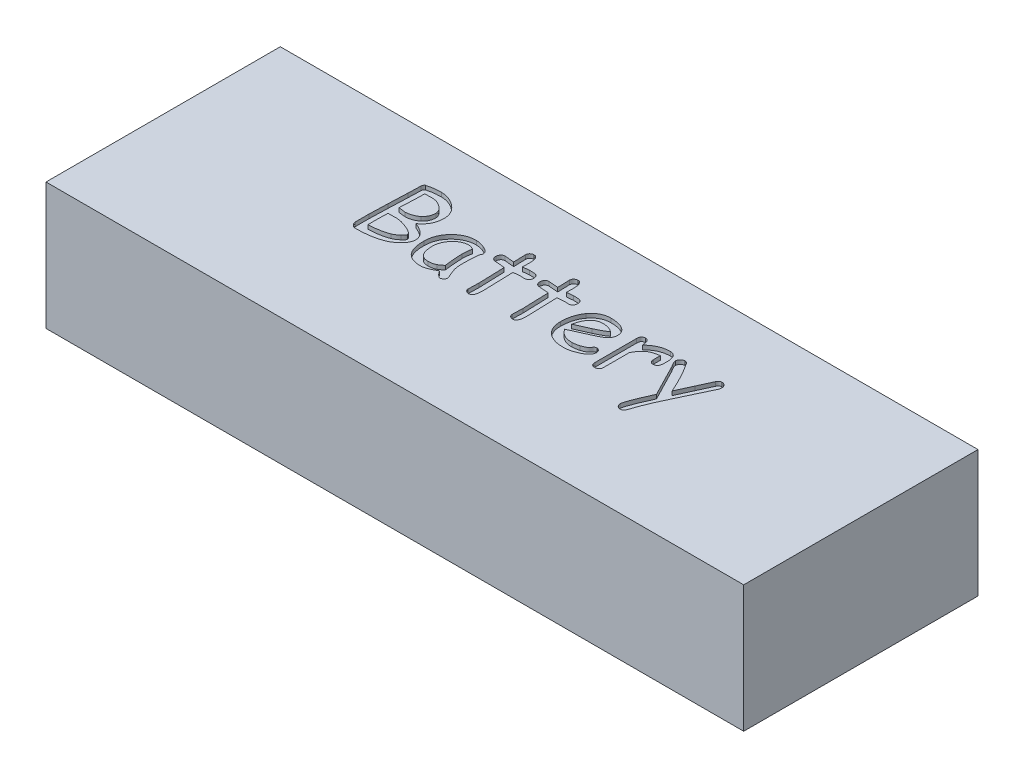
from build123d import *

# Parameters (mm, degrees)
SKETCH1_W           = 136.906
SKETCH1_H           = 45.974
BOSS_EXTRUDE1_DEPTH = 24.892
CUT_EXTRUDE1_DEPTH  = 0.79375


with BuildPart() as part:
    # Sketch1 → Boss-Extrude1 (new body)
    with BuildSketch(Plane(origin=(0, 0, 0), x_dir=(1, 0, 0), z_dir=(0, 1, 0))):
        Rectangle(SKETCH1_W, SKETCH1_H)
    extrude(amount=BOSS_EXTRUDE1_DEPTH)

    # Sketch2 → Cut-Extrude1 (cut)
    # profile 1 of 7: a face of its own
    with BuildSketch(Plane(origin=(0, 24.892, 0), x_dir=(1, 0, 0), z_dir=(0, 1, 0))):
        with BuildLine():
            add(Edge.make_bspline(
                [(-25.187474213, 0.283035049), (-25.357803893, 0.219193014), (-25.706357139, 0.088550201), (-26.255416364, -0.0710962), (-26.838574292, -0.205197941), (-27.456567078, -0.315880138), (-28.108751778, -0.40304193), (-28.796386754, -0.462400617), (-29.517223284, -0.500128275), (-30.009602327, -0.505257631), (-30.260943604, -0.507875977)],
                knots=[0, 0, 0, 0, 0.845148608, 1.729465408, 2.654896534, 3.625080711, 4.646240167, 5.711756778, 6.831936531, 8, 8, 8, 8], degree=3))
            add(Edge.make_bspline(
                [(-30.260943604, -0.507875977), (-30.324140737, -0.502940378), (-30.451313693, -0.493008367), (-30.638276885, -0.420723863), (-30.818321547, -0.305299883), (-30.985191566, -0.148383564), (-31.128659408, 0.029935653), (-31.238577295, 0.217978156), (-31.306286107, 0.41164244), (-31.314821228, 0.543533071), (-31.319018555, 0.608393097)],
                knots=[0, 0, 0, 0, 0.905166651, 1.821486394, 2.83904999, 3.957846056, 5.091625874, 6.111309478, 7.071196234, 8, 8, 8, 8], degree=3))
            Line((-31.319018555, 0.608393097), (-31.319018555, 3.224483414))
            add(Edge.make_bspline(
                [(-31.319018555, 3.224483414), (-31.318296118, 3.337346422), (-31.316777815, 3.574543801), (-31.311070947, 3.947516089), (-31.30371577, 4.354915432), (-31.290473699, 4.796689907), (-31.270205718, 5.271813018), (-31.253437001, 5.781588539), (-31.22916266, 6.325613956), (-31.20990827, 6.700271044), (-31.199985123, 6.893358307)],
                knots=[0, 0, 0, 0, 0.737849974, 1.550694791, 2.438561872, 3.401627494, 4.439981643, 5.54745813, 6.736031923, 8, 8, 8, 8], degree=3))
            add(Edge.make_bspline(
                [(-31.199985123, 6.893358307), (-31.189140744, 7.100551724), (-31.168285036, 7.499022252), (-31.142382479, 8.074863222), (-31.118699793, 8.606548988), (-31.096526243, 9.094073454), (-31.081636991, 9.53765626), (-31.067171675, 9.936139865), (-31.059831047, 10.290645746), (-31.056194736, 10.511973832), (-31.054499817, 10.615136948)],
                knots=[0, 0, 0, 0, 1.336822694, 2.570952543, 3.714018919, 4.766024101, 5.715397503, 6.573729646, 7.335201894, 8, 8, 8, 8], degree=3))
            add(Edge.make_bspline(
                [(-31.054499817, 10.615136948), (-31.054663976, 10.688321054), (-31.055012083, 10.843511368), (-31.052063806, 11.088643523), (-31.046697627, 11.359339771), (-31.038714813, 11.65472493), (-31.028002879, 11.975674949), (-31.014778104, 12.321316765), (-30.998839241, 12.692525586), (-30.98670923, 12.948196924), (-30.98043457, 13.080451584)],
                knots=[0, 0, 0, 0, 0.712050298, 1.509935911, 2.385153873, 3.346337456, 4.384953733, 5.509610457, 6.71176165, 8, 8, 8, 8], degree=3))
            add(Edge.make_bspline(
                [(-30.98043457, 13.080451584), (-30.96870284, 13.14987009), (-30.94703802, 13.278064266), (-30.882768176, 13.44807515), (-30.800474007, 13.585726955), (-30.721511784, 13.644963073), (-30.684173584, 13.672973557)],
                knots=[0, 0, 0, 0, 1.23418656, 2.279154888, 3.186278501, 4, 4, 4, 4], degree=3))
            add(Edge.make_bspline(
                [(-30.684173584, 13.672973557), (-30.474360908, 13.732522104), (-30.045721343, 13.854177592), (-29.369019911, 13.964216805), (-28.653489648, 14.038977484), (-28.161761154, 14.047077739), (-27.909372025, 14.051235352)],
                knots=[0, 0, 0, 0, 0.930556381, 1.901092399, 2.922695212, 4, 4, 4, 4], degree=3))
            add(Edge.make_bspline(
                [(-27.909372025, 14.051235352), (-27.777828632, 14.048415998), (-27.515533955, 14.042794267), (-27.124362471, 13.990057018), (-26.737411086, 13.906128494), (-26.355168714, 13.78490777), (-25.975746902, 13.634936057), (-25.60169468, 13.447382076), (-25.230065626, 13.22895861), (-24.993097711, 13.058570984), (-24.872696915, 12.971998901)],
                knots=[0, 0, 0, 0, 0.962147252, 1.918500801, 2.882873772, 3.856291195, 4.84954284, 5.865236775, 6.91535024, 8, 8, 8, 8], degree=3))
            add(Edge.make_bspline(
                [(-24.872696915, 12.971998901), (-24.739174349, 12.867843218), (-24.479724078, 12.665456302), (-24.135171877, 12.326867125), (-23.84542668, 11.968820116), (-23.606717074, 11.59192893), (-23.419520015, 11.197138965), (-23.290604024, 10.781948025), (-23.207405972, 10.35041574), (-23.197847259, 10.055625574), (-23.19300293, 9.90622673)],
                knots=[0, 0, 0, 0, 1.117202605, 2.170857918, 3.180777677, 4.15128398, 5.109476991, 6.055661985, 7.014614856, 8, 8, 8, 8], degree=3))
            add(Edge.make_bspline(
                [(-23.19300293, 9.90622673), (-23.198304406, 9.718062057), (-23.208668914, 9.350195828), (-23.298153292, 8.814687328), (-23.443578442, 8.309877674), (-23.649133635, 7.835378919), (-23.911528203, 7.390575814), (-24.23690407, 6.980577378), (-24.616613657, 6.598121264), (-24.906892109, 6.376860618), (-25.055214844, 6.263803711)],
                knots=[0, 0, 0, 0, 1.058953792, 2.070278829, 3.047589135, 4.010504305, 4.974404593, 5.94679655, 6.95088062, 8, 8, 8, 8], degree=3))
            add(Edge.make_bspline(
                [(-25.055214844, 6.263803711), (-24.945502076, 6.216137763), (-24.730528302, 6.122739984), (-24.422773655, 5.972311038), (-24.135276633, 5.81910596), (-23.871031881, 5.66014167), (-23.627200859, 5.498954769), (-23.403652081, 5.335138895), (-23.201883811, 5.165766915), (-23.021959189, 4.991199927), (-22.862767111, 4.813648314), (-22.722972236, 4.634033591), (-22.609353999, 4.446506796), (-22.51343582, 4.256790153), (-22.438841814, 4.062719057), (-22.385413172, 3.86515695), (-22.352515738, 3.662927339), (-22.348543806, 3.526157091), (-22.346542969, 3.457259903)],
                knots=[0, 0, 0, 0, 1.389510839, 2.722640191, 3.978357324, 5.172924784, 6.30364197, 7.373077171, 8.390833472, 9.361520877, 10.282794515, 11.15966198, 12.001175195, 12.825747472, 13.626629272, 14.411832578, 15.199970237, 16, 16, 16, 16], degree=3))
            add(Edge.make_bspline(
                [(-22.346542969, 3.457259903), (-22.350420607, 3.367095158), (-22.35824045, 3.185264351), (-22.412400749, 2.914499857), (-22.504460827, 2.646658514), (-22.632321376, 2.381222176), (-22.798235596, 2.119130318), (-22.998887914, 1.858591828), (-23.233375726, 1.599301733), (-23.411113064, 1.437513242), (-23.502489853, 1.354335938)],
                knots=[0, 0, 0, 0, 0.874407195, 1.76337398, 2.666706198, 3.61537891, 4.614412331, 5.66984113, 6.80203881, 8, 8, 8, 8], degree=3))
            add(Edge.make_bspline(
                [(-23.502489853, 1.354335938), (-23.635388926, 1.23978138), (-23.896961982, 1.014314152), (-24.317183957, 0.725872687), (-24.742668897, 0.473920371), (-25.040472226, 0.34612), (-25.187474213, 0.283035049)],
                knots=[0, 0, 0, 0, 1.04855267, 2.063770054, 3.044236175, 4, 4, 4, 4], degree=3))
        make_face()
        with BuildLine():
            add(Edge.make_bspline(
                [(-27.885565338, 12.189023438), (-28.039011435, 12.189254489), (-28.322165853, 12.189680849), (-28.70921003, 12.174711735), (-29.023683958, 12.160034395), (-29.207352434, 12.137861501), (-29.287514648, 12.128184128)],
                knots=[0, 0, 0, 0, 1.311143454, 2.419455882, 3.310170582, 4, 4, 4, 4], degree=3))
            Line((-29.287514648, 12.128184128), (-29.303385773, 10.617782135))
            Line((-29.303385773, 10.617782135), (-29.456806641, 7.279555664))
            add(Edge.make_bspline(
                [(-29.456806641, 7.279555664), (-29.355445177, 7.265168428), (-29.165183828, 7.238162751), (-28.897813057, 7.204434922), (-28.668554106, 7.17537271), (-28.476390878, 7.151258986), (-28.322073847, 7.132465607), (-28.205636985, 7.120536007), (-28.127347857, 7.10922812), (-28.087494987, 7.109992739), (-28.073373642, 7.110263672)],
                knots=[0, 0, 0, 0, 1.762393324, 3.308114521, 4.639196962, 5.740586565, 6.642425824, 7.314598078, 7.75713677, 8, 8, 8, 8], degree=3))
            add(Edge.make_bspline(
                [(-28.073373642, 7.110263672), (-27.961254938, 7.121437622), (-27.741517015, 7.143337097), (-27.420278083, 7.195446694), (-27.114200143, 7.269568358), (-26.824933643, 7.365285158), (-26.54933188, 7.475286382), (-26.292417997, 7.609832315), (-26.047849095, 7.758044257), (-25.898836591, 7.874957686), (-25.824964371, 7.932916946)],
                knots=[0, 0, 0, 0, 1.111640606, 2.178669459, 3.208442161, 4.215432668, 5.183209707, 6.132667044, 7.074278815, 8, 8, 8, 8], degree=3))
            add(Edge.make_bspline(
                [(-25.824964371, 7.932916946), (-25.750163146, 7.998270502), (-25.602830612, 8.126994397), (-25.412726985, 8.345966674), (-25.249722563, 8.576926961), (-25.116571247, 8.821952287), (-25.012416891, 9.081023092), (-24.938029843, 9.35430055), (-24.896072959, 9.642177952), (-24.889346362, 9.838202189), (-24.885922852, 9.937968979)],
                knots=[0, 0, 0, 0, 1.039321603, 2.047104005, 3.028387125, 3.995399141, 4.960910613, 5.946659751, 6.95494981, 8, 8, 8, 8], degree=3))
            add(Edge.make_bspline(
                [(-24.885922852, 9.937968979), (-24.889171734, 10.006989724), (-24.895695409, 10.145581638), (-24.942822256, 10.350315403), (-25.016805241, 10.551300479), (-25.125665937, 10.745359021), (-25.261591244, 10.93739212), (-25.429151113, 11.124585481), (-25.626932499, 11.307145325), (-25.84850011, 11.484392272), (-26.087240856, 11.647962137), (-26.334341093, 11.791307542), (-26.583572122, 11.913350291), (-26.835715489, 12.015608765), (-27.09378093, 12.092013158), (-27.35477111, 12.14680185), (-27.619112156, 12.183816893), (-27.796386088, 12.187280858), (-27.885565338, 12.189023438)],
                knots=[0, 0, 0, 0, 0.811227325, 1.628923975, 2.459084342, 3.322265874, 4.23721336, 5.221517372, 6.270705122, 7.399480973, 8.555739175, 9.670905582, 10.756115058, 11.817125015, 12.866978737, 13.916422681, 14.951837649, 16, 16, 16, 16], degree=3))
        make_face(mode=Mode.SUBTRACT)
        with BuildLine():
            Line((-26.869813385, 5.118437576), (-27.822080841, 5.274503632))
            add(Edge.make_bspline(
                [(-27.822080841, 5.274503632), (-27.870587033, 5.273943913), (-27.988843479, 5.272579337), (-28.176535804, 5.261281503), (-28.366869445, 5.249803909), (-28.487774104, 5.248572671), (-28.53892662, 5.248051758)],
                knots=[0, 0, 0, 0, 0.811283348, 1.977881213, 3.144479079, 4, 4, 4, 4], degree=3))
            add(Edge.make_bspline(
                [(-28.53892662, 5.248051758), (-28.706455154, 5.248051758), (-29.051211243, 5.248051758), (-29.395967331, 5.248051758), (-29.573194885, 5.248051758)],
                knots=[0, 0, 0, 0, 0.971867008, 2, 2, 2, 2], degree=3))
            add(Edge.make_bspline(
                [(-29.573194885, 5.248051758), (-29.581702353, 5.063791424), (-29.59822511, 4.705930644), (-29.61287886, 4.183853608), (-29.625148152, 3.691857641), (-29.625788331, 3.373502998), (-29.626098633, 3.219193039)],
                knots=[0, 0, 0, 0, 1.090500536, 2.117913084, 3.087731999, 4, 4, 4, 4], degree=3))
            Line((-29.626098633, 3.219193039), (-29.626098633, 1.354335938))
            add(Edge.make_bspline(
                [(-29.626098633, 1.354335938), (-29.434688456, 1.362771796), (-29.060309063, 1.379271502), (-28.512466759, 1.424734318), (-27.990942252, 1.484872428), (-27.496794636, 1.561421211), (-27.030019818, 1.65198086), (-26.592540978, 1.766002342), (-26.17894405, 1.885722279), (-25.917786115, 1.987310829), (-25.790576935, 2.036794281)],
                knots=[0, 0, 0, 0, 1.174548874, 2.297301542, 3.369463097, 4.392417447, 5.362455501, 6.282842997, 7.163578407, 8, 8, 8, 8], degree=3))
            add(Edge.make_bspline(
                [(-25.790576935, 2.036794281), (-25.685350192, 2.081148559), (-25.47185609, 2.171138771), (-25.169102641, 2.352814837), (-24.868744053, 2.561414605), (-24.682469074, 2.725240251), (-24.587016678, 2.809188995)],
                knots=[0, 0, 0, 0, 0.951928983, 1.931364762, 2.939974703, 4, 4, 4, 4], degree=3))
            add(Edge.make_bspline(
                [(-24.587016678, 2.809188995), (-24.504853936, 2.882436009), (-24.358634325, 3.012788887), (-24.188425709, 3.207717068), (-24.069174515, 3.369836864), (-24.048222994, 3.479981761), (-24.039462891, 3.526034775)],
                knots=[0, 0, 0, 0, 1.433431585, 2.550983634, 3.394147416, 4, 4, 4, 4], degree=3))
            add(Edge.make_bspline(
                [(-24.039462891, 3.526034775), (-24.043574611, 3.563607227), (-24.052265847, 3.64302678), (-24.111006964, 3.759807013), (-24.203683298, 3.876883695), (-24.333862039, 3.994582874), (-24.495787478, 4.119616715), (-24.695292376, 4.24478693), (-24.929576548, 4.374843505), (-25.09975429, 4.45796895), (-25.1901194, 4.502108917)],
                knots=[0, 0, 0, 0, 0.575185487, 1.215810285, 1.966963897, 2.855761369, 3.896008111, 5.098876818, 6.459491156, 8, 8, 8, 8], degree=3))
            add(Edge.make_bspline(
                [(-25.1901194, 4.502108917), (-25.332416364, 4.567717711), (-25.612715744, 4.696955214), (-26.035031406, 4.866064922), (-26.452411868, 5.008711707), (-26.731784666, 5.082152799), (-26.869813385, 5.118437576)],
                knots=[0, 0, 0, 0, 1.049024965, 2.066390161, 3.044668301, 4, 4, 4, 4], degree=3))
        make_face(mode=Mode.SUBTRACT)
    # profile 2 of 7: a face of its own
    with BuildSketch(Plane(origin=(0, 24.892, 0), x_dir=(1, 0, 0), z_dir=(0, 1, 0))):
        with BuildLine():
            add(Edge.make_bspline(
                [(-13.532778626, -0.677167969), (-13.567891552, -0.669225637), (-13.654720776, -0.649585391), (-13.790346093, -0.553904689), (-13.962568234, -0.416205915), (-14.084001175, -0.298466854), (-14.151752472, -0.232776489)],
                knots=[0, 0, 0, 0, 0.555695463, 1.374155035, 2.534957635, 4, 4, 4, 4], degree=3))
            add(Edge.make_bspline(
                [(-14.151752472, -0.232776489), (-14.215134449, -0.16645714), (-14.33688352, -0.039065735), (-14.498030962, 0.153319138), (-14.640205874, 0.33031113), (-14.716171649, 0.450742857), (-14.752210007, 0.507875977)],
                knots=[0, 0, 0, 0, 1.151952229, 2.212760143, 3.152128841, 4, 4, 4, 4], degree=3))
            add(Edge.make_bspline(
                [(-14.752210007, 0.507875977), (-14.891108038, 0.42866092), (-15.158145592, 0.276366501), (-15.549676997, 0.068701823), (-15.916822786, -0.106076571), (-16.257370329, -0.249625713), (-16.571700157, -0.362182635), (-16.85813957, -0.445600741), (-17.11958041, -0.496986781), (-17.285228053, -0.504396603), (-17.363009949, -0.507875977)],
                knots=[0, 0, 0, 0, 1.357382431, 2.60962722, 3.761399541, 4.808177135, 5.745711274, 6.593953003, 7.339773276, 8, 8, 8, 8], degree=3))
            add(Edge.make_bspline(
                [(-17.363009949, -0.507875977), (-17.532472411, -0.504610677), (-17.86002524, -0.498299202), (-18.33357288, -0.441743181), (-18.771783024, -0.351227388), (-19.173824842, -0.22038456), (-19.543544935, -0.057694007), (-19.874464659, 0.148099887), (-20.175244784, 0.385716478), (-20.340733982, 0.576480439), (-20.423491745, 0.671877594)],
                knots=[0, 0, 0, 0, 1.198237041, 2.31606415, 3.368011987, 4.358092637, 5.301625415, 6.21724908, 7.108482723, 8, 8, 8, 8], degree=3))
            add(Edge.make_bspline(
                [(-20.423491745, 0.671877594), (-20.4963117, 0.769103729), (-20.644929376, 0.967531788), (-20.829995625, 1.302689242), (-20.985636564, 1.674575953), (-21.110706179, 2.083616288), (-21.212165034, 2.528088069), (-21.281376682, 3.00930449), (-21.324581948, 3.527881585), (-21.328672912, 3.88568834), (-21.330791016, 4.070943375)],
                knots=[0, 0, 0, 0, 0.812552431, 1.658331892, 2.555229492, 3.507519434, 4.518618694, 5.604829532, 6.759896565, 8, 8, 8, 8], degree=3))
            add(Edge.make_bspline(
                [(-21.330791016, 4.070943375), (-21.326150912, 4.248393596), (-21.317019637, 4.597598409), (-21.246712162, 5.111538296), (-21.130572972, 5.606095342), (-20.965885383, 6.080918269), (-20.755143978, 6.535883158), (-20.500863182, 6.972044955), (-20.196295405, 7.386470756), (-19.85035133, 7.776327616), (-19.472034198, 8.133531198), (-19.073260264, 8.449928275), (-18.654286009, 8.717268864), (-18.21732415, 8.935159375), (-17.760701785, 9.101961201), (-17.288956049, 9.224747135), (-16.797462685, 9.297837465), (-16.463891819, 9.306603983), (-16.294354248, 9.31105957)],
                knots=[0, 0, 0, 0, 1.054731984, 2.075610185, 3.077564362, 4.070606348, 5.058056501, 6.05423441, 7.067099876, 8.110607853, 9.148928189, 10.156761868, 11.132552149, 12.098435385, 13.053748134, 14.01750944, 14.992398115, 16, 16, 16, 16], degree=3))
            add(Edge.make_bspline(
                [(-16.294354248, 9.31105957), (-16.16093016, 9.305128034), (-15.8834262, 9.292791245), (-15.456748666, 9.215214845), (-15.007244772, 9.087046191), (-14.707164996, 8.968150801), (-14.551175766, 8.906345901)],
                knots=[0, 0, 0, 0, 0.889365109, 1.849758484, 2.882248842, 4, 4, 4, 4], degree=3))
            add(Edge.make_bspline(
                [(-14.551175766, 8.906345901), (-14.455253908, 8.864614242), (-14.273544557, 8.785559968), (-14.025108962, 8.650220117), (-13.815188992, 8.508429044), (-13.64224111, 8.359569491), (-13.50770149, 8.202697251), (-13.410470842, 8.039347685), (-13.346883681, 7.868693752), (-13.340311798, 7.750928155), (-13.33703476, 7.692204895)],
                knots=[0, 0, 0, 0, 1.381705711, 2.617431031, 3.732296057, 4.723070722, 5.624086893, 6.449303074, 7.226752293, 8, 8, 8, 8], degree=3))
            add(Edge.make_bspline(
                [(-13.33703476, 7.692204895), (-13.338691807, 7.652210097), (-13.341961465, 7.573293048), (-13.379797675, 7.459960154), (-13.434388693, 7.351437547), (-13.488920108, 7.289951113), (-13.516907501, 7.258394165)],
                knots=[0, 0, 0, 0, 0.993157303, 1.959680908, 2.952838212, 4, 4, 4, 4], degree=3))
            add(Edge.make_bspline(
                [(-13.516907501, 7.258394165), (-13.532151917, 7.192464361), (-13.566653939, 7.043248303), (-13.595143083, 6.788543341), (-13.633072934, 6.480582603), (-13.656441714, 6.116734882), (-13.676982577, 5.697851829), (-13.696855773, 5.224397448), (-13.705239206, 4.69522419), (-13.710099915, 4.3239988), (-13.712651367, 4.129137497)],
                knots=[0, 0, 0, 0, 0.516827984, 1.169714305, 1.956377237, 2.888851328, 3.955038626, 5.162311074, 6.510458132, 8, 8, 8, 8], degree=3))
            add(Edge.make_bspline(
                [(-13.712651367, 4.129137497), (-13.71177384, 3.952734161), (-13.710113912, 3.619050049), (-13.680962659, 3.148517685), (-13.634777049, 2.735037558), (-13.579664587, 2.482617757), (-13.553940125, 2.364797516)],
                knots=[0, 0, 0, 0, 1.19200198, 2.25478799, 3.185399486, 4, 4, 4, 4], degree=3))
            add(Edge.make_bspline(
                [(-13.553940125, 2.364797516), (-13.544545824, 2.327680842), (-13.523379406, 2.244052787), (-13.4805525, 2.107396583), (-13.424143017, 1.946615627), (-13.358669142, 1.760870839), (-13.27814511, 1.551427231), (-13.186339124, 1.316564484), (-13.079222099, 1.057333343), (-13.00540427, 0.875597358), (-12.966708527, 0.780330276)],
                knots=[0, 0, 0, 0, 0.543324072, 1.224170439, 2.031506418, 2.961691587, 4.019197454, 5.215989979, 6.540605439, 8, 8, 8, 8], degree=3))
            add(Edge.make_bspline(
                [(-12.966708527, 0.780330276), (-12.954485545, 0.750301244), (-12.927377661, 0.683703456), (-12.879299859, 0.574132553), (-12.818003703, 0.44642241), (-12.775236635, 0.353636958), (-12.752448349, 0.304196548)],
                knots=[0, 0, 0, 0, 0.745010443, 1.652269271, 2.749019729, 4, 4, 4, 4], degree=3))
            Line((-12.752448349, 0.304196548), (-12.696899414, 0.150775681))
            add(Edge.make_bspline(
                [(-12.696899414, 0.150775681), (-12.699610261, 0.093041087), (-12.704882797, -0.019251411), (-12.756108614, -0.178651886), (-12.831787977, -0.32560195), (-12.944677313, -0.447145579), (-13.074217071, -0.548368102), (-13.217177906, -0.623647968), (-13.372476823, -0.667186143), (-13.478729988, -0.673802417), (-13.532778626, -0.677167969)],
                knots=[0, 0, 0, 0, 1.055781092, 2.053470688, 3.044847395, 4.064324308, 5.067244292, 6.051071831, 7.008623294, 8, 8, 8, 8], degree=3))
        make_face()
        with BuildLine():
            add(Edge.make_bspline(
                [(-15.405571289, 5.626313553), (-15.402314676, 5.762145136), (-15.395517723, 6.045642414), (-15.361393706, 6.487426359), (-15.295624555, 6.959899454), (-15.239036603, 7.284132476), (-15.209827423, 7.451492844)],
                knots=[0, 0, 0, 0, 0.88697149, 1.851218968, 2.890857011, 4, 4, 4, 4], degree=3))
            add(Edge.make_bspline(
                [(-15.209827423, 7.451492844), (-15.312117204, 7.50375093), (-15.49876887, 7.59910805), (-15.764197772, 7.701525758), (-15.982453727, 7.769915383), (-16.115039816, 7.782124346), (-16.172675629, 7.787431641)],
                knots=[0, 0, 0, 0, 1.341238509, 2.447403828, 3.325078951, 4, 4, 4, 4], degree=3))
            add(Edge.make_bspline(
                [(-16.172675629, 7.787431641), (-16.288366516, 7.783686289), (-16.517436242, 7.776270436), (-16.854969338, 7.722780416), (-17.179163124, 7.631706774), (-17.492846727, 7.507498609), (-17.790821902, 7.340324052), (-18.081781452, 7.145051025), (-18.357603802, 6.909989195), (-18.616263562, 6.641930463), (-18.853192729, 6.351948056), (-19.065861365, 6.049844137), (-19.23911776, 5.732459463), (-19.387315833, 5.407390751), (-19.496916666, 5.068637145), (-19.581032153, 4.720676656), (-19.628583702, 4.360591376), (-19.634760815, 4.116923688), (-19.637871094, 3.994232941)],
                knots=[0, 0, 0, 0, 0.976615751, 1.933714126, 2.876548638, 3.815200477, 4.774727746, 5.755505532, 6.769702424, 7.827890142, 8.896423243, 9.928951538, 10.941972897, 11.945015674, 12.940821975, 13.942980332, 14.964256267, 16, 16, 16, 16], degree=3))
            add(Edge.make_bspline(
                [(-19.637871094, 3.994232941), (-19.636785241, 3.874247434), (-19.634674543, 3.641017838), (-19.605913465, 3.303154961), (-19.569174252, 2.987209926), (-19.509954279, 2.695843769), (-19.437940809, 2.42679992), (-19.343226058, 2.183022065), (-19.239688181, 1.958472579), (-19.114135195, 1.759481525), (-18.973749675, 1.582068301), (-18.813957736, 1.431499144), (-18.639361932, 1.302160085), (-18.448890235, 1.195459384), (-18.238841185, 1.116357096), (-18.014290742, 1.059546738), (-17.773523661, 1.019715906), (-17.607420868, 1.017101064), (-17.521721191, 1.015751953)],
                knots=[0, 0, 0, 0, 1.385053073, 2.692286587, 3.913500936, 5.055672189, 6.122813422, 7.125029461, 8.072314099, 8.973498475, 9.835345066, 10.677972226, 11.50067925, 12.339298428, 13.190189537, 14.084155314, 15.011532147, 16, 16, 16, 16], degree=3))
            add(Edge.make_bspline(
                [(-17.521721191, 1.015751953), (-17.381319691, 1.02001332), (-17.109833206, 1.028253287), (-16.718875948, 1.085716695), (-16.359909515, 1.184643388), (-16.141603598, 1.284479723), (-16.035125885, 1.333174438)],
                knots=[0, 0, 0, 0, 1.098427608, 2.12396769, 3.084973818, 4, 4, 4, 4], degree=3))
            add(Edge.make_bspline(
                [(-16.035125885, 1.333174438), (-15.974641696, 1.368497597), (-15.838711924, 1.447881465), (-15.626552626, 1.600306438), (-15.381944927, 1.795390026), (-15.21186442, 1.943484322), (-15.119891052, 2.023568344)],
                knots=[0, 0, 0, 0, 0.731520458, 1.643990121, 2.725955338, 4, 4, 4, 4], degree=3))
            add(Edge.make_bspline(
                [(-15.119891052, 2.023568344), (-15.142232964, 2.217515907), (-15.185479453, 2.592933695), (-15.24332558, 3.137889282), (-15.294751585, 3.644719963), (-15.333564893, 4.113980889), (-15.366840526, 4.545027627), (-15.387205827, 4.939316247), (-15.401500931, 5.295564442), (-15.404269031, 5.520494663), (-15.405571289, 5.626313553)],
                knots=[0, 0, 0, 0, 1.29584854, 2.508330538, 3.637509546, 4.677124825, 5.633672839, 6.506959432, 7.297595963, 8, 8, 8, 8], degree=3))
        make_face(mode=Mode.SUBTRACT)
    # profile 3 of 7: a face of its own
    with BuildSketch(Plane(origin=(0, 24.892, 0), x_dir=(1, 0, 0), z_dir=(0, 1, 0))):
        with BuildLine():
            add(Edge.make_bspline(
                [(-5.129018326, 7.552009964), (-5.198692689, 7.553322859), (-5.350480916, 7.556183051), (-5.583114385, 7.570422342), (-5.815732332, 7.584944658), (-5.966642267, 7.587748192), (-6.036317596, 7.589042587)],
                knots=[0, 0, 0, 0, 0.920717115, 2.005816965, 3.079282885, 4, 4, 4, 4], degree=3))
            add(Edge.make_bspline(
                [(-6.036317596, 7.589042587), (-6.058363126, 7.588222167), (-6.110418404, 7.586284939), (-6.201335404, 7.581106579), (-6.317711302, 7.569923029), (-6.460571647, 7.554089787), (-6.628780773, 7.532135447), (-6.822985094, 7.509218035), (-7.042282031, 7.479025745), (-7.197535644, 7.459279525), (-7.279555664, 7.448847656)],
                knots=[0, 0, 0, 0, 0.423045876, 0.998922293, 1.745956013, 2.664623774, 3.755177246, 4.998829415, 6.414490547, 8, 8, 8, 8], degree=3))
            Line((-7.279555664, 7.448847656), (-7.118199234, 2.253699646))
            Line((-7.118199234, 2.253699646), (-7.110263672, 1.864857101))
            Line((-7.110263672, 1.864857101), (-7.099682922, 1.417820435))
            add(Edge.make_bspline(
                [(-7.099682922, 1.417820435), (-7.0988038, 1.266958674), (-7.097165574, 0.985830814), (-7.133509588, 0.592466259), (-7.198676147, 0.25846608), (-7.295791153, -0.017071504), (-7.420050886, -0.237709099), (-7.586710543, -0.393189857), (-7.784444615, -0.494202299), (-7.929952845, -0.503250509), (-8.004337006, -0.507875977)],
                knots=[0, 0, 0, 0, 1.528621386, 2.848555227, 3.998559243, 4.968438543, 5.802376151, 6.536002899, 7.251601123, 8, 8, 8, 8], degree=3))
            add(Edge.make_bspline(
                [(-8.004337006, -0.507875977), (-8.060264645, -0.50596128), (-8.17052897, -0.502186352), (-8.32729142, -0.453524707), (-8.475540199, -0.38418724), (-8.607179111, -0.284766729), (-8.719718284, -0.164024176), (-8.800137126, -0.02367726), (-8.850268228, 0.130691553), (-8.855872603, 0.238566813), (-8.858732529, 0.293615799)],
                knots=[0, 0, 0, 0, 1.02652806, 2.023854815, 2.99735258, 4.030413798, 5.0421858, 6.01730832, 6.988227997, 8, 8, 8, 8], degree=3))
            add(Edge.make_bspline(
                [(-8.858732529, 0.293615799), (-8.857956525, 0.356220318), (-8.856218562, 0.49643151), (-8.850753596, 0.726568305), (-8.842385736, 0.99901061), (-8.833283977, 1.298858169), (-8.818398246, 1.599369651), (-8.811481186, 1.871898339), (-8.805623387, 2.102021861), (-8.803939989, 2.241353045), (-8.803183594, 2.303958206)],
                knots=[0, 0, 0, 0, 0.747128177, 1.673293467, 2.746990194, 3.999802079, 5.253011562, 6.337225674, 7.252871823, 8, 8, 8, 8], degree=3))
            Line((-8.803183594, 2.303958206), (-8.972475586, 7.448847656))
            add(Edge.make_bspline(
                [(-8.972475586, 7.448847656), (-9.028923328, 7.451194044), (-9.148957901, 7.456183573), (-9.338427779, 7.470485105), (-9.549157516, 7.48633943), (-9.780186938, 7.504704544), (-10.032351215, 7.526010598), (-10.304786826, 7.550023907), (-10.598565956, 7.575678201), (-10.801209891, 7.596684888), (-10.906107559, 7.607558899)],
                knots=[0, 0, 0, 0, 0.69876017, 1.485894292, 2.349961702, 3.312734694, 4.352486331, 5.480100212, 6.695585878, 8, 8, 8, 8], degree=3))
            add(Edge.make_bspline(
                [(-10.906107559, 7.607558899), (-10.967396978, 7.618999148), (-11.083341529, 7.640641295), (-11.244097681, 7.699690196), (-11.381857883, 7.781029691), (-11.491532864, 7.889948875), (-11.5785018, 8.017121476), (-11.640491991, 8.166270353), (-11.672947212, 8.338013529), (-11.678324522, 8.459183066), (-11.681147461, 8.522793732)],
                knots=[0, 0, 0, 0, 1.119713667, 2.118223711, 3.064630397, 3.972940108, 4.874581196, 5.819924503, 6.855520493, 8, 8, 8, 8], degree=3))
            add(Edge.make_bspline(
                [(-11.681147461, 8.522793732), (-11.67815707, 8.588323181), (-11.672382504, 8.714863185), (-11.626328909, 8.895240806), (-11.551473593, 9.057066377), (-11.447574538, 9.19887019), (-11.318750652, 9.313609405), (-11.172699315, 9.402262), (-11.007350514, 9.45390904), (-10.891473069, 9.459148208), (-10.832042313, 9.461835251)],
                knots=[0, 0, 0, 0, 1.10983231, 2.143130888, 3.132909426, 4.116573268, 5.101031898, 6.039351675, 6.994430595, 8, 8, 8, 8], degree=3))
            Line((-10.832042313, 9.461835251), (-8.972475586, 9.31105957))
            add(Edge.make_bspline(
                [(-8.972475586, 9.31105957), (-8.973012584, 9.393948909), (-8.974172473, 9.572985566), (-8.983814047, 9.861262946), (-8.992465383, 10.188536646), (-9.011886211, 10.538440714), (-9.03158972, 10.881267096), (-9.04012639, 11.186503606), (-9.049896207, 11.438615735), (-9.051238954, 11.588559197), (-9.051831207, 11.654695587)],
                knots=[0, 0, 0, 0, 0.848238914, 1.8321519, 2.951624046, 4.198441437, 5.418224434, 6.465550233, 7.323191773, 8, 8, 8, 8], degree=3))
            add(Edge.make_bspline(
                [(-9.051831207, 11.654695587), (-9.048926629, 11.714984577), (-9.043234195, 11.833139838), (-8.994629162, 12.000614735), (-8.915454292, 12.152596817), (-8.804328782, 12.282121643), (-8.672246629, 12.391373007), (-8.523500753, 12.472095627), (-8.358867296, 12.518602911), (-8.245342725, 12.5245457), (-8.186854935, 12.527607422)],
                knots=[0, 0, 0, 0, 1.054098555, 2.065838051, 3.025944053, 4.034260515, 5.032715164, 6.013703489, 6.976661236, 8, 8, 8, 8], degree=3))
            add(Edge.make_bspline(
                [(-8.186854935, 12.527607422), (-8.124654245, 12.523595973), (-8.004072887, 12.515819436), (-7.832232432, 12.453039408), (-7.687884937, 12.341406901), (-7.559228079, 12.194662045), (-7.458434009, 12.002759296), (-7.377649887, 11.771668228), (-7.314026301, 11.500336851), (-7.2915248, 11.304104484), (-7.279555664, 11.199723358)],
                knots=[0, 0, 0, 0, 0.839179043, 1.626820346, 2.427236251, 3.279915469, 4.244758927, 5.33359862, 6.581671405, 8, 8, 8, 8], degree=3))
            add(Edge.make_bspline(
                [(-7.279555664, 11.199723358), (-7.271228272, 11.077207355), (-7.253031451, 10.809488292), (-7.253078352, 10.54113399), (-7.25310379, 10.395586395)],
                knots=[0, 0, 0, 0, 0.915257976, 2, 2, 2, 2], degree=3))
            Line((-7.25310379, 10.395586395), (-7.271620102, 9.871839294))
            Line((-7.271620102, 9.871839294), (-7.279555664, 9.31105957))
            add(Edge.make_bspline(
                [(-7.279555664, 9.31105957), (-7.191387912, 9.322554343), (-7.025681193, 9.344158173), (-6.792116437, 9.374116668), (-6.588135661, 9.396165665), (-6.414077148, 9.420481193), (-6.267941264, 9.430031718), (-6.152995054, 9.446517029), (-6.067196249, 9.450816534), (-6.020445076, 9.453025049), (-6.001930161, 9.453899689)],
                knots=[0, 0, 0, 0, 1.659498559, 3.118941497, 4.394719153, 5.488798678, 6.397639186, 7.126385805, 7.654021676, 8, 8, 8, 8], degree=3))
            add(Edge.make_bspline(
                [(-6.001930161, 9.453899689), (-5.927870099, 9.452854728), (-5.785920735, 9.450851874), (-5.583001499, 9.450560534), (-5.399720991, 9.440344335), (-5.2363599, 9.434673872), (-5.093405157, 9.421369074), (-4.971184022, 9.404087916), (-4.867781431, 9.391466917), (-4.807054888, 9.374298687), (-4.779853592, 9.366608505)],
                knots=[0, 0, 0, 0, 1.447613272, 2.774609975, 3.964759937, 5.034410691, 5.968933724, 6.76833278, 7.448298163, 8, 8, 8, 8], degree=3))
            add(Edge.make_bspline(
                [(-4.779853592, 9.366608505), (-4.735816111, 9.350698355), (-4.650232838, 9.319778267), (-4.538975396, 9.246053888), (-4.442442102, 9.159975985), (-4.366865807, 9.05521012), (-4.303955957, 8.937466669), (-4.262808502, 8.801848878), (-4.235710579, 8.651739436), (-4.233462976, 8.545850676), (-4.232299805, 8.491051483)],
                knots=[0, 0, 0, 0, 1.005767345, 1.954627295, 2.855857429, 3.779451047, 4.722967414, 5.720622874, 6.820384471, 8, 8, 8, 8], degree=3))
            add(Edge.make_bspline(
                [(-4.232299805, 8.491051483), (-4.234976165, 8.425426212), (-4.240153435, 8.298477794), (-4.290911966, 8.118054552), (-4.365866219, 7.952549364), (-4.480034378, 7.813330182), (-4.612808677, 7.695889263), (-4.76922718, 7.611637935), (-4.943228444, 7.559821519), (-5.066047571, 7.554657576), (-5.129018326, 7.552009964)],
                knots=[0, 0, 0, 0, 1.079895878, 2.088998209, 3.071435682, 4.05505688, 5.03479875, 5.978573441, 6.963591752, 8, 8, 8, 8], degree=3))
        make_face()
    # profile 4 of 7: a face of its own
    with BuildSketch(Plane(origin=(0, 24.892, 0), x_dir=(1, 0, 0), z_dir=(0, 1, 0))):
        with BuildLine():
            add(Edge.make_bspline(
                [(3.504873276, 7.552009964), (3.435198913, 7.553322859), (3.283410685, 7.556183051), (3.050777216, 7.570422342), (2.81815927, 7.584944658), (2.667249335, 7.587748192), (2.597574005, 7.589042587)],
                knots=[0, 0, 0, 0, 0.920717115, 2.005816965, 3.079282885, 4, 4, 4, 4], degree=3))
            add(Edge.make_bspline(
                [(2.597574005, 7.589042587), (2.575528476, 7.588222167), (2.523473197, 7.586284939), (2.432556198, 7.581106579), (2.3161803, 7.569923029), (2.173319955, 7.554089787), (2.005110828, 7.532135447), (1.810906507, 7.509218035), (1.59160957, 7.479025745), (1.436355957, 7.459279525), (1.354335937, 7.448847656)],
                knots=[0, 0, 0, 0, 0.423045876, 0.998922293, 1.745956013, 2.664623774, 3.755177246, 4.998829415, 6.414490547, 8, 8, 8, 8], degree=3))
            Line((1.354335937, 7.448847656), (1.515692368, 2.253699646))
            Line((1.515692368, 2.253699646), (1.52362793, 1.864857101))
            Line((1.52362793, 1.864857101), (1.534208679, 1.417820435))
            add(Edge.make_bspline(
                [(1.534208679, 1.417820435), (1.535087801, 1.266958674), (1.536726028, 0.985830814), (1.500382013, 0.592466259), (1.435215454, 0.25846608), (1.338100449, -0.017071504), (1.213840715, -0.237709099), (1.047181059, -0.393189857), (0.849446987, -0.494202299), (0.703938757, -0.503250509), (0.629554596, -0.507875977)],
                knots=[0, 0, 0, 0, 1.528621386, 2.848555227, 3.998559243, 4.968438543, 5.802376151, 6.536002899, 7.251601123, 8, 8, 8, 8], degree=3))
            add(Edge.make_bspline(
                [(0.629554596, -0.507875977), (0.573626956, -0.50596128), (0.463362631, -0.502186352), (0.306600182, -0.453524707), (0.158351402, -0.38418724), (0.02671249, -0.284766729), (-0.085826682, -0.164024176), (-0.166245525, -0.02367726), (-0.216376626, 0.130691553), (-0.221981002, 0.238566813), (-0.224840927, 0.293615799)],
                knots=[0, 0, 0, 0, 1.02652806, 2.023854815, 2.99735258, 4.030413798, 5.0421858, 6.01730832, 6.988227997, 8, 8, 8, 8], degree=3))
            add(Edge.make_bspline(
                [(-0.224840927, 0.293615799), (-0.224064924, 0.356220318), (-0.222326961, 0.49643151), (-0.216861995, 0.726568305), (-0.208494135, 0.99901061), (-0.199392375, 1.298858169), (-0.184506644, 1.599369651), (-0.177589585, 1.871898339), (-0.171731785, 2.102021861), (-0.170048387, 2.241353045), (-0.169291992, 2.303958206)],
                knots=[0, 0, 0, 0, 0.747128177, 1.673293467, 2.746990194, 3.999802079, 5.253011562, 6.337225674, 7.252871823, 8, 8, 8, 8], degree=3))
            Line((-0.169291992, 2.303958206), (-0.338583984, 7.448847656))
            add(Edge.make_bspline(
                [(-0.338583984, 7.448847656), (-0.395031727, 7.451194044), (-0.515066299, 7.456183573), (-0.704536177, 7.470485105), (-0.915265915, 7.48633943), (-1.146295336, 7.504704544), (-1.398459613, 7.526010598), (-1.670895225, 7.550023907), (-1.964674354, 7.575678201), (-2.16731829, 7.596684888), (-2.272215958, 7.607558899)],
                knots=[0, 0, 0, 0, 0.69876017, 1.485894292, 2.349961702, 3.312734694, 4.352486331, 5.480100212, 6.695585878, 8, 8, 8, 8], degree=3))
            add(Edge.make_bspline(
                [(-2.272215958, 7.607558899), (-2.333505376, 7.618999148), (-2.449449928, 7.640641295), (-2.61020608, 7.699690196), (-2.747966282, 7.781029691), (-2.857641262, 7.889948875), (-2.944610198, 8.017121476), (-3.00660039, 8.166270353), (-3.03905561, 8.338013529), (-3.04443292, 8.459183066), (-3.047255859, 8.522793732)],
                knots=[0, 0, 0, 0, 1.119713667, 2.118223711, 3.064630397, 3.972940108, 4.874581196, 5.819924503, 6.855520493, 8, 8, 8, 8], degree=3))
            add(Edge.make_bspline(
                [(-3.047255859, 8.522793732), (-3.044265468, 8.588323181), (-3.038490902, 8.714863185), (-2.992437307, 8.895240806), (-2.917581992, 9.057066377), (-2.813682937, 9.19887019), (-2.684859051, 9.313609405), (-2.538807713, 9.402262), (-2.373458913, 9.45390904), (-2.257581468, 9.459148208), (-2.198150711, 9.461835251)],
                knots=[0, 0, 0, 0, 1.10983231, 2.143130888, 3.132909426, 4.116573268, 5.101031898, 6.039351675, 6.994430595, 8, 8, 8, 8], degree=3))
            Line((-2.198150711, 9.461835251), (-0.338583984, 9.31105957))
            add(Edge.make_bspline(
                [(-0.338583984, 9.31105957), (-0.339120983, 9.393948909), (-0.340280871, 9.572985566), (-0.349922446, 9.861262946), (-0.358573782, 10.188536646), (-0.377994609, 10.538440714), (-0.397698118, 10.881267096), (-0.406234788, 11.186503606), (-0.416004606, 11.438615735), (-0.417347353, 11.588559197), (-0.417939606, 11.654695587)],
                knots=[0, 0, 0, 0, 0.848238914, 1.8321519, 2.951624046, 4.198441437, 5.418224434, 6.465550233, 7.323191773, 8, 8, 8, 8], degree=3))
            add(Edge.make_bspline(
                [(-0.417939606, 11.654695587), (-0.415035028, 11.714984577), (-0.409342593, 11.833139838), (-0.360737561, 12.000614735), (-0.28156269, 12.152596817), (-0.17043718, 12.282121643), (-0.038355028, 12.391373007), (0.110390849, 12.472095627), (0.275024305, 12.518602911), (0.388548876, 12.5245457), (0.447036667, 12.527607422)],
                knots=[0, 0, 0, 0, 1.054098555, 2.065838051, 3.025944053, 4.034260515, 5.032715164, 6.013703489, 6.976661236, 8, 8, 8, 8], degree=3))
            add(Edge.make_bspline(
                [(0.447036667, 12.527607422), (0.509237357, 12.523595973), (0.629818715, 12.515819436), (0.80165917, 12.453039408), (0.946006665, 12.341406901), (1.074663522, 12.194662045), (1.175457592, 12.002759296), (1.256241714, 11.771668228), (1.319865301, 11.500336851), (1.342366801, 11.304104484), (1.354335937, 11.199723358)],
                knots=[0, 0, 0, 0, 0.839179043, 1.626820346, 2.427236251, 3.279915469, 4.244758927, 5.33359862, 6.581671405, 8, 8, 8, 8], degree=3))
            add(Edge.make_bspline(
                [(1.354335937, 11.199723358), (1.36266333, 11.077207355), (1.38086015, 10.809488292), (1.380813249, 10.54113399), (1.380787811, 10.395586395)],
                knots=[0, 0, 0, 0, 0.915257976, 2, 2, 2, 2], degree=3))
            Line((1.380787811, 10.395586395), (1.3622715, 9.871839294))
            Line((1.3622715, 9.871839294), (1.354335937, 9.31105957))
            add(Edge.make_bspline(
                [(1.354335937, 9.31105957), (1.44250369, 9.322554343), (1.608210409, 9.344158173), (1.841775164, 9.374116668), (2.045755941, 9.396165665), (2.219814453, 9.420481193), (2.365950338, 9.430031718), (2.480896547, 9.446517029), (2.566695353, 9.450816534), (2.613446526, 9.453025049), (2.631961441, 9.453899689)],
                knots=[0, 0, 0, 0, 1.659498559, 3.118941497, 4.394719153, 5.488798678, 6.397639186, 7.126385805, 7.654021676, 8, 8, 8, 8], degree=3))
            add(Edge.make_bspline(
                [(2.631961441, 9.453899689), (2.706021502, 9.452854728), (2.847970867, 9.450851874), (3.050890103, 9.450560534), (3.234170611, 9.440344335), (3.397531702, 9.434673872), (3.540486445, 9.421369074), (3.662707579, 9.404087916), (3.766110171, 9.391466917), (3.826836713, 9.374298687), (3.85403801, 9.366608505)],
                knots=[0, 0, 0, 0, 1.447613272, 2.774609975, 3.964759937, 5.034410691, 5.968933724, 6.76833278, 7.448298163, 8, 8, 8, 8], degree=3))
            add(Edge.make_bspline(
                [(3.85403801, 9.366608505), (3.89807549, 9.350698355), (3.983658764, 9.319778267), (4.094916206, 9.246053888), (4.1914495, 9.159975985), (4.267025795, 9.05521012), (4.329935645, 8.937466669), (4.371083099, 8.801848878), (4.398181023, 8.651739436), (4.400428625, 8.545850676), (4.401591797, 8.491051483)],
                knots=[0, 0, 0, 0, 1.005767345, 1.954627295, 2.855857429, 3.779451047, 4.722967414, 5.720622874, 6.820384471, 8, 8, 8, 8], degree=3))
            add(Edge.make_bspline(
                [(4.401591797, 8.491051483), (4.398915436, 8.425426212), (4.393738167, 8.298477794), (4.342979636, 8.118054552), (4.268025382, 7.952549364), (4.153857223, 7.813330182), (4.021082925, 7.695889263), (3.864664422, 7.611637935), (3.690663157, 7.559821519), (3.56784403, 7.554657576), (3.504873276, 7.552009964)],
                knots=[0, 0, 0, 0, 1.079895878, 2.088998209, 3.071435682, 4.05505688, 5.03479875, 5.978573441, 6.963591752, 8, 8, 8, 8], degree=3))
        make_face()
    # profile 5 of 7: a face of its own
    with BuildSketch(Plane(origin=(0, 24.892, 0), x_dir=(1, 0, 0), z_dir=(0, 1, 0))):
        with BuildLine():
            add(Edge.make_bspline(
                [(10.342682648, -0.338583984), (10.180307332, -0.33574101), (9.861889272, -0.330165935), (9.39716172, -0.280574669), (8.954896652, -0.206723101), (8.538304249, -0.093044495), (8.142840075, 0.0443962), (7.773719368, 0.219849353), (7.423176718, 0.417250116), (7.212515181, 0.580171737), (7.107618484, 0.661296844)],
                knots=[0, 0, 0, 0, 1.128309966, 2.212616298, 3.245415885, 4.241483204, 5.210735126, 6.151190939, 7.079404977, 8, 8, 8, 8], degree=3))
            add(Edge.make_bspline(
                [(7.107618484, 0.661296844), (6.999417954, 0.755824584), (6.785670749, 0.942561562), (6.509596223, 1.26298416), (6.276326289, 1.611358004), (6.086648966, 1.987527679), (5.936705837, 2.391042827), (5.832316578, 2.821616964), (5.767143154, 3.279804486), (5.759732034, 3.594583004), (5.755927734, 3.756166077)],
                knots=[0, 0, 0, 0, 0.98512053, 1.946078805, 2.892696337, 3.856166527, 4.830766296, 5.840559039, 6.891509153, 8, 8, 8, 8], degree=3))
            add(Edge.make_bspline(
                [(5.755927734, 3.756166077), (5.75952542, 3.944103176), (5.766583429, 4.312801747), (5.820852463, 4.85458311), (5.907397544, 5.373531281), (6.027655008, 5.869597824), (6.188001511, 6.340648228), (6.382118575, 6.78875196), (6.606565105, 7.217559897), (6.789180814, 7.48142937), (6.88013237, 7.612849274)],
                knots=[0, 0, 0, 0, 1.104185823, 2.166212721, 3.196015826, 4.193778621, 5.162103834, 6.115918395, 7.061635205, 8, 8, 8, 8], degree=3))
            add(Edge.make_bspline(
                [(6.88013237, 7.612849274), (6.983097311, 7.747491233), (7.184986985, 8.011491979), (7.530594416, 8.359817347), (7.904651501, 8.653244368), (8.302318438, 8.896410151), (8.727166379, 9.082538631), (9.176623001, 9.215640662), (9.652014208, 9.296505898), (9.978209918, 9.306149498), (10.144293594, 9.31105957)],
                knots=[0, 0, 0, 0, 1.060623447, 2.079629439, 3.062684112, 4.031384342, 4.990596895, 5.958399794, 6.960512181, 8, 8, 8, 8], degree=3))
            add(Edge.make_bspline(
                [(10.144293594, 9.31105957), (10.26513801, 9.309685956), (10.500899233, 9.307006105), (10.845910441, 9.281778513), (11.174466082, 9.245810756), (11.486792781, 9.194287701), (11.780502462, 9.121974707), (12.056701662, 9.036736526), (12.318515735, 8.941219006), (12.481563822, 8.859410541), (12.561994858, 8.819054718)],
                knots=[0, 0, 0, 0, 1.164260711, 2.271412601, 3.331636946, 4.348488907, 5.319067774, 6.243556088, 7.133552517, 8, 8, 8, 8], degree=3))
            add(Edge.make_bspline(
                [(12.561994858, 8.819054718), (12.653466779, 8.767646307), (12.831005454, 8.667867259), (13.065833127, 8.482210965), (13.26605585, 8.27845808), (13.430836327, 8.052423509), (13.557380196, 7.80585444), (13.649285963, 7.538885404), (13.701829304, 7.251643113), (13.708987012, 7.053163272), (13.712651367, 6.951552429)],
                knots=[0, 0, 0, 0, 1.084932816, 2.105755861, 3.086994856, 4.034665786, 4.990043621, 5.94559589, 6.948257257, 8, 8, 8, 8], degree=3))
            add(Edge.make_bspline(
                [(13.712651367, 6.951552429), (13.709595342, 6.878988905), (13.703455166, 6.733194038), (13.653531216, 6.518721998), (13.575605136, 6.308832679), (13.466407551, 6.103425536), (13.321335878, 5.905709022), (13.148119787, 5.71233446), (12.945886876, 5.521916594), (12.79250801, 5.407862486), (12.712770538, 5.348568878)],
                knots=[0, 0, 0, 0, 0.885949184, 1.780051946, 2.676748195, 3.616748064, 4.612588657, 5.665830448, 6.786529176, 8, 8, 8, 8], degree=3))
            add(Edge.make_bspline(
                [(12.712770538, 5.348568878), (12.670522009, 5.322004985), (12.577070962, 5.263247353), (12.421050698, 5.168996612), (12.229502708, 5.071823968), (12.011719924, 4.956397107), (11.7600332, 4.835409787), (11.479630267, 4.700409896), (11.165438822, 4.558302301), (10.946651405, 4.458934677), (10.832042313, 4.406882172)],
                knots=[0, 0, 0, 0, 0.569019432, 1.258634601, 2.0770468, 3.016741689, 4.068770326, 5.260338806, 6.564862248, 8, 8, 8, 8], degree=3))
            Line((10.832042313, 4.406882172), (7.448847656, 2.885899429))
            add(Edge.make_bspline(
                [(7.448847656, 2.885899429), (7.533113747, 2.764484292), (7.698212993, 2.526600375), (7.993835572, 2.215424008), (8.315056316, 1.948109687), (8.667479865, 1.727817721), (9.053570431, 1.561670204), (9.467934148, 1.439204932), (9.913428926, 1.367275268), (10.219859498, 1.358723382), (10.377070084, 1.354335938)],
                knots=[0, 0, 0, 0, 1.024237451, 2.006748275, 2.967141875, 3.917879489, 4.879519493, 5.874579679, 6.909578207, 8, 8, 8, 8], degree=3))
            add(Edge.make_bspline(
                [(10.377070084, 1.354335938), (10.482132139, 1.357874037), (10.702798206, 1.365305249), (11.045664443, 1.41327613), (11.414971963, 1.487247236), (11.666548156, 1.556398161), (11.797535706, 1.592402802)],
                knots=[0, 0, 0, 0, 0.872791092, 1.833158294, 2.871795923, 4, 4, 4, 4], degree=3))
            add(Edge.make_bspline(
                [(11.797535706, 1.592402802), (11.879820698, 1.618023801), (12.038584716, 1.667458002), (12.262881917, 1.752098903), (12.465754229, 1.840455156), (12.642469884, 1.940173014), (12.801106465, 2.038615343), (12.933380295, 2.147935258), (13.044895928, 2.261043933), (13.149723535, 2.418714478), (13.267127631, 2.593136002), (13.422043907, 2.756595743), (13.593461952, 2.856518901), (13.713364114, 2.871014597), (13.770845489, 2.877963867)],
                knots=[0, 0, 0, 0, 1.279185782, 2.468113163, 3.558006391, 4.55991789, 5.478584209, 6.325021446, 7.102775046, 7.825600419, 9.129727565, 10.221976642, 11.147611454, 12, 12, 12, 12], degree=3))
            add(Edge.make_bspline(
                [(13.770845489, 2.877963867), (13.820529347, 2.874656618), (13.920154837, 2.86802496), (14.065171598, 2.821834666), (14.200521764, 2.74225308), (14.32099422, 2.634436632), (14.427415648, 2.510876561), (14.502519997, 2.369805968), (14.549635734, 2.21963586), (14.555938874, 2.115605846), (14.559111328, 2.063246155)],
                knots=[0, 0, 0, 0, 0.953628141, 1.912203997, 2.890906518, 3.946963299, 5.004918733, 6.004920361, 6.99584986, 8, 8, 8, 8], degree=3))
            add(Edge.make_bspline(
                [(14.559111328, 2.063246155), (14.554811337, 1.978038461), (14.546222701, 1.807847915), (14.466894108, 1.558950183), (14.340301117, 1.321739984), (14.164272207, 1.092950036), (13.936066669, 0.878641034), (13.664064282, 0.666898917), (13.339172031, 0.470465967), (13.101661476, 0.352659742), (12.977289276, 0.290970612)],
                knots=[0, 0, 0, 0, 0.813678559, 1.625210031, 2.47455903, 3.377551647, 4.374225337, 5.462963274, 6.671482876, 8, 8, 8, 8], degree=3))
            add(Edge.make_bspline(
                [(12.977289276, 0.290970612), (12.755165671, 0.194313783), (12.322041914, 0.005840483), (11.654137935, -0.188223775), (10.996467338, -0.314977207), (10.558378873, -0.330795651), (10.342682648, -0.338583984)],
                knots=[0, 0, 0, 0, 1.064134946, 2.074980394, 3.052201788, 4, 4, 4, 4], degree=3))
        make_face()
        with BuildLine():
            add(Edge.make_bspline(
                [(10.191906967, 7.618139648), (10.101827063, 7.615556935), (9.925299096, 7.610495639), (9.666711745, 7.571904457), (9.419464167, 7.512679444), (9.185174622, 7.423417625), (8.960957639, 7.312308462), (8.749316531, 7.174088555), (8.549867891, 7.010940817), (8.360722673, 6.824545916), (8.183938378, 6.612610905), (8.019348787, 6.374899397), (7.866281406, 6.113198685), (7.726095331, 5.825358886), (7.597228942, 5.513197382), (7.47828827, 5.175886765), (7.369236845, 4.814265066), (7.309945838, 4.562419768), (7.279555664, 4.433334045)],
                knots=[0, 0, 0, 0, 0.918282655, 1.799541994, 2.660990009, 3.506092074, 4.350572019, 5.208540181, 6.077836691, 6.974377545, 7.912693382, 8.888022104, 9.919750727, 11.001519221, 12.150417669, 13.36196731, 14.647851047, 16, 16, 16, 16], degree=3))
            Line((7.279555664, 4.433334045), (10.038486099, 5.660700989))
            add(Edge.make_bspline(
                [(10.038486099, 5.660700989), (10.169141439, 5.721201573), (10.421470625, 5.838043817), (10.785000557, 6.013075908), (11.120079607, 6.180789321), (11.425168953, 6.345090424), (11.699850968, 6.503884404), (11.946830267, 6.654180779), (12.164837329, 6.798652363), (12.296191924, 6.898866347), (12.35831543, 6.946262054)],
                knots=[0, 0, 0, 0, 1.300232032, 2.511083682, 3.643469266, 4.683758506, 5.63979056, 6.50832501, 7.294519693, 8, 8, 8, 8], degree=3))
            add(Edge.make_bspline(
                [(12.35831543, 6.946262054), (12.291714005, 7.000971129), (12.158065329, 7.110755498), (11.931796171, 7.244126624), (11.690229202, 7.362179066), (11.427849288, 7.45734927), (11.145479334, 7.527070051), (10.845178912, 7.580667098), (10.524998528, 7.612368761), (10.304839023, 7.616183075), (10.191906967, 7.618139648)],
                knots=[0, 0, 0, 0, 0.891368842, 1.78870445, 2.711691234, 3.673605972, 4.672432659, 5.720309362, 6.83061987, 8, 8, 8, 8], degree=3))
        make_face(mode=Mode.SUBTRACT)
    # profile 6 of 7: a face of its own
    with BuildSketch(Plane(origin=(0, 24.892, 0), x_dir=(1, 0, 0), z_dir=(0, 1, 0))):
        with BuildLine():
            add(Edge.make_bspline(
                [(23.015775375, 6.692324066), (23.007920753, 6.605667979), (22.993128886, 6.442476787), (22.944329573, 6.214798744), (22.869504866, 6.020357849), (22.763203649, 5.863692465), (22.63702431, 5.736483069), (22.48195836, 5.647569817), (22.301971241, 5.597310564), (22.174928717, 5.590301828), (22.108476105, 5.586635742)],
                knots=[0, 0, 0, 0, 1.295735659, 2.440136123, 3.460018604, 4.378359426, 5.242460733, 6.107859715, 7.010271055, 8, 8, 8, 8], degree=3))
            add(Edge.make_bspline(
                [(22.108476105, 5.586635742), (22.04742934, 5.588945532), (21.931807791, 5.593320235), (21.769649222, 5.631878208), (21.632683604, 5.70229882), (21.522205682, 5.801023745), (21.431173271, 5.922832739), (21.371110729, 6.075896085), (21.338884255, 6.254501951), (21.333585562, 6.381819281), (21.330791016, 6.448966827)],
                knots=[0, 0, 0, 0, 1.100945868, 2.085173012, 2.982023122, 3.850321592, 4.738374668, 5.701796776, 6.787920652, 8, 8, 8, 8], degree=3))
            add(Edge.make_bspline(
                [(21.330791016, 6.448966827), (21.330791016, 6.482472534), (21.330791016, 6.560946426), (21.330791016, 6.695850983), (21.330791016, 6.865142975), (21.330791016, 6.989466782), (21.330791016, 7.057359924)],
                knots=[0, 0, 0, 0, 0.660869565, 1.547826087, 2.660869565, 4, 4, 4, 4], degree=3))
            Line((21.330791016, 7.057359924), (21.330791016, 7.787431641))
            add(Edge.make_bspline(
                [(21.330791016, 7.787431641), (21.216882497, 7.771732069), (20.993496403, 7.740943627), (20.668243705, 7.677882195), (20.360584037, 7.599072407), (20.071345489, 7.502883554), (19.798882212, 7.395157947), (19.543489051, 7.273814738), (19.306787655, 7.135893545), (19.160137267, 7.031991278), (19.087672119, 6.98064949)],
                knots=[0, 0, 0, 0, 1.144544546, 2.244567291, 3.296285563, 4.303892079, 5.276994686, 6.211401458, 7.116190149, 8, 8, 8, 8], degree=3))
            add(Edge.make_bspline(
                [(19.087672119, 6.98064949), (19.022350075, 6.929751601), (18.889593633, 6.826309909), (18.706301967, 6.648387171), (18.530869461, 6.453016513), (18.359843978, 6.242360564), (18.203954836, 6.007556986), (18.047742447, 5.759464095), (17.9067476, 5.489272843), (17.819851609, 5.301316927), (17.77565918, 5.20572876)],
                knots=[0, 0, 0, 0, 0.890283466, 1.809356499, 2.742804578, 3.714549466, 4.724786913, 5.772446687, 6.867140002, 8, 8, 8, 8], degree=3))
            Line((17.77565918, 5.20572876), (17.77565918, 0.238066864))
            add(Edge.make_bspline(
                [(17.77565918, 0.238066864), (17.773718996, 0.166392218), (17.770062136, 0.031299777), (17.727208757, -0.158022018), (17.657060366, -0.319683527), (17.555291578, -0.4510781), (17.427160382, -0.556356828), (17.26669934, -0.625201925), (17.081779509, -0.672393266), (16.948939645, -0.675520235), (16.878940659, -0.677167969)],
                knots=[0, 0, 0, 0, 1.169988332, 2.205195145, 3.153754388, 4.027492201, 4.898847955, 5.834278863, 6.858789227, 8, 8, 8, 8], degree=3))
            add(Edge.make_bspline(
                [(16.878940659, -0.677167969), (16.815993784, -0.675502521), (16.697043592, -0.672355339), (16.532326853, -0.62586217), (16.391620004, -0.552929966), (16.275913327, -0.450651218), (16.185129763, -0.318450868), (16.127012144, -0.156371043), (16.089440867, 0.03179158), (16.085066498, 0.166434491), (16.082739258, 0.238066864)],
                knots=[0, 0, 0, 0, 1.085331691, 2.05094241, 2.930880279, 3.805915949, 4.694138553, 5.673972165, 6.762512688, 8, 8, 8, 8], degree=3))
            Line((16.082739258, 0.238066864), (16.082739258, 6.599742508))
            add(Edge.make_bspline(
                [(16.082739258, 6.599742508), (16.082739258, 6.656173172), (16.082739258, 6.781378708), (16.082739258, 6.987703323), (16.082739258, 7.231060562), (16.082739258, 7.499106216), (16.082739258, 7.767151871), (16.082739258, 8.00962738), (16.082739258, 8.215070267), (16.082739258, 8.339394073), (16.082739258, 8.395824738)],
                knots=[0, 0, 0, 0, 0.754050074, 1.673048601, 2.756995582, 4.005891016, 5.254786451, 6.338733432, 7.245949926, 8, 8, 8, 8], degree=3))
            add(Edge.make_bspline(
                [(16.082739258, 8.395824738), (16.085089522, 8.467439314), (16.089507166, 8.602048773), (16.126793124, 8.790431943), (16.186086098, 8.952485904), (16.274118456, 9.08707328), (16.392694605, 9.18650665), (16.53216173, 9.259927004), (16.697092687, 9.306195433), (16.816010774, 9.309376298), (16.878940659, 9.31105957)],
                knots=[0, 0, 0, 0, 1.237087611, 2.325276542, 3.304793673, 4.205332221, 5.070066379, 5.949720033, 6.915018865, 8, 8, 8, 8], degree=3))
            add(Edge.make_bspline(
                [(16.878940659, 9.31105957), (16.949349165, 9.307100496), (17.08454596, 9.299498373), (17.271926655, 9.223312802), (17.431194905, 9.102485925), (17.560053649, 8.932201998), (17.656194278, 8.714631474), (17.726418346, 8.452461169), (17.766572065, 8.143976556), (17.772503431, 7.923337606), (17.77565918, 7.805947952)],
                knots=[0, 0, 0, 0, 0.855057838, 1.641862399, 2.424762198, 3.267971087, 4.215845516, 5.308999801, 6.568269197, 8, 8, 8, 8], degree=3))
            add(Edge.make_bspline(
                [(17.77565918, 7.805947952), (17.918083025, 7.938959684), (18.197579777, 8.199985826), (18.646562648, 8.541806768), (19.107668431, 8.831752186), (19.58052716, 9.068856553), (20.064319945, 9.253214032), (20.560163058, 9.382401002), (21.067875327, 9.465626579), (21.411587724, 9.475418827), (21.584729004, 9.480351563)],
                knots=[0, 0, 0, 0, 1.094663653, 2.148200216, 3.165632785, 4.151789181, 5.116294069, 6.069428244, 7.027496045, 8, 8, 8, 8], degree=3))
            add(Edge.make_bspline(
                [(21.584729004, 9.480351563), (21.643041627, 9.479167679), (21.756783489, 9.476858451), (21.921644992, 9.449004608), (22.07539153, 9.407516392), (22.218309357, 9.349044884), (22.348255669, 9.271120009), (22.468135752, 9.178706637), (22.575636864, 9.068104829), (22.670116855, 8.940148094), (22.756278617, 8.796554928), (22.826100641, 8.633908133), (22.887550108, 8.455403853), (22.936872497, 8.259712015), (22.976421378, 8.04679986), (23.005593627, 7.817232826), (23.020765576, 7.56985404), (23.022706294, 7.399489736), (23.023710937, 7.311297913)],
                knots=[0, 0, 0, 0, 0.946650493, 1.846491943, 2.708580394, 3.530810561, 4.34664878, 5.163492966, 5.984223624, 6.843927316, 7.743312341, 8.699135496, 9.714128082, 10.8088212, 11.975068048, 13.231562893, 14.566873974, 16, 16, 16, 16], degree=3))
            add(Edge.make_bspline(
                [(23.023710937, 7.311297913), (23.02402189, 7.240757202), (23.024585521, 7.112895382), (23.021187118, 6.9392055), (23.018968818, 6.803409437), (23.016713202, 6.7249468), (23.015775375, 6.692324066)],
                knots=[0, 0, 0, 0, 1.367341291, 2.478437557, 3.367373725, 4, 4, 4, 4], degree=3))
        make_face()
    # profile 7 of 7: a face of its own
    with BuildSketch(Plane(origin=(0, 24.892, 0), x_dir=(1, 0, 0), z_dir=(0, 1, 0))):
        with BuildLine():
            Line((32.813549423, 7.924981384), (29.673712006, 1.267044754))
            add(Edge.make_bspline(
                [(29.673712006, 1.267044754), (29.580046123, 1.068750564), (29.39708307, 0.681410914), (29.132246637, 0.111952492), (28.882779821, -0.432218174), (28.653280443, -0.954024937), (28.438640636, -1.449929419), (28.242798548, -1.922023552), (28.062885018, -2.368196884), (27.950504011, -2.658291477), (27.896146088, -2.798608246)],
                knots=[0, 0, 0, 0, 1.185835995, 2.316362875, 3.395946504, 4.422714135, 5.398712484, 6.317793961, 7.186328456, 8, 8, 8, 8], degree=3))
            Line((27.896146088, -2.798608246), (27.29833374, -4.525915604))
            add(Edge.make_bspline(
                [(27.29833374, -4.525915604), (27.278508528, -4.582887709), (27.240782538, -4.691301636), (27.165702115, -4.838655336), (27.080902805, -4.964392777), (26.985669421, -5.070395776), (26.876032907, -5.150143939), (26.755920501, -5.207320592), (26.625839038, -5.242820484), (26.534980091, -5.246291592), (26.488906403, -5.248051758)],
                knots=[0, 0, 0, 0, 1.235991964, 2.352006154, 3.380181255, 4.339930222, 5.258597469, 6.140212165, 7.05691968, 8, 8, 8, 8], degree=3))
            add(Edge.make_bspline(
                [(26.488906403, -5.248051758), (26.427747373, -5.245144412), (26.307881754, -5.239446303), (26.133897871, -5.189789634), (25.974746891, -5.106709146), (25.832326437, -4.99563147), (25.711457506, -4.861937733), (25.627503845, -4.705322342), (25.569914907, -4.5351657), (25.565400667, -4.415307475), (25.56309082, -4.353978424)],
                knots=[0, 0, 0, 0, 1.023606654, 2.006167323, 3.004277025, 4.015323613, 5.020520316, 5.999517743, 6.976393346, 8, 8, 8, 8], degree=3))
            add(Edge.make_bspline(
                [(25.56309082, -4.353978424), (25.564737828, -4.310667333), (25.568392493, -4.214561245), (25.598553373, -4.059595549), (25.638603489, -3.878066138), (25.690796428, -3.670255474), (25.76077578, -3.436809953), (25.845757637, -3.177612983), (25.945862391, -2.892581176), (26.064192348, -2.582351359), (26.192703162, -2.245108472), (26.33528959, -1.880982749), (26.497518275, -1.494069706), (26.672654172, -1.079517718), (26.861930039, -0.638999203), (27.069749192, -0.173603667), (27.2884227, 0.319193053), (27.441747655, 0.655263212), (27.52052948, 0.827943649)],
                knots=[0, 0, 0, 0, 0.373930967, 0.82974225, 1.360148952, 1.980874544, 2.679813033, 3.465064369, 4.337133929, 5.289256639, 6.333227822, 7.454891416, 8.667164621, 9.957383291, 11.342606331, 12.808949494, 14.360366181, 16, 16, 16, 16], degree=3))
            Line((27.52052948, 0.827943649), (24.341014252, 7.004456177))
            Line((24.341014252, 7.004456177), (23.941590958, 7.657817459))
            add(Edge.make_bspline(
                [(23.941590958, 7.657817459), (23.904843559, 7.723231022), (23.836303563, 7.845238172), (23.761653862, 8.027224339), (23.712264896, 8.192218805), (23.704503316, 8.298555519), (23.700878906, 8.348211365)],
                knots=[0, 0, 0, 0, 1.217991762, 2.271756755, 3.19296566, 4, 4, 4, 4], degree=3))
            add(Edge.make_bspline(
                [(23.700878906, 8.348211365), (23.704821243, 8.410228833), (23.712612401, 8.53279269), (23.763449381, 8.711290982), (23.854369608, 8.875224883), (23.97431516, 9.024026603), (24.11712448, 9.147261884), (24.269346601, 9.245238681), (24.43535258, 9.299608206), (24.548751311, 9.307238756), (24.605532989, 9.31105957)],
                knots=[0, 0, 0, 0, 1.023084226, 2.021900477, 3.03051496, 4.095730577, 5.157366296, 6.13011498, 7.063700203, 8, 8, 8, 8], degree=3))
            add(Edge.make_bspline(
                [(24.605532989, 9.31105957), (24.670492732, 9.307379104), (24.795914196, 9.300273017), (24.972168026, 9.233750415), (25.123391202, 9.121597542), (25.197051266, 9.019767725), (25.235087585, 8.967185211)],
                knots=[0, 0, 0, 0, 1.03565372, 1.999595438, 2.967038292, 4, 4, 4, 4], degree=3))
            add(Edge.make_bspline(
                [(25.235087585, 8.967185211), (25.36341254, 8.782043109), (25.629705459, 8.397846356), (26.016512128, 7.782348517), (26.413613636, 7.113495443), (26.815344417, 6.386793744), (27.224271206, 5.60391618), (27.642283738, 4.765658076), (28.065205972, 3.870816444), (28.343299366, 3.253155079), (28.486022873, 2.93615799)],
                knots=[0, 0, 0, 0, 0.787796816, 1.634792816, 2.541842998, 3.508143451, 4.538559296, 5.630857437, 6.784105113, 8, 8, 8, 8], degree=3))
            Line((28.486022873, 2.93615799), (29.887972183, 5.991349411))
            add(Edge.make_bspline(
                [(29.887972183, 5.991349411), (30.005121382, 6.248869437), (30.231896266, 6.747371131), (30.563076543, 7.470146876), (30.872380384, 8.143467571), (31.070428106, 8.576553002), (31.165597687, 8.784667282)],
                knots=[0, 0, 0, 0, 1.105263586, 2.13954533, 3.105979663, 4, 4, 4, 4], degree=3))
            add(Edge.make_bspline(
                [(31.165597687, 8.784667282), (31.212995204, 8.86430726), (31.301772351, 9.013475624), (31.484964589, 9.182613026), (31.690421602, 9.294685522), (31.839661174, 9.305606201), (31.914185715, 9.31105957)],
                knots=[0, 0, 0, 0, 1.149695914, 2.153419211, 3.077888109, 4, 4, 4, 4], degree=3))
            add(Edge.make_bspline(
                [(31.914185715, 9.31105957), (31.973691815, 9.308481556), (32.092513028, 9.303333801), (32.262990606, 9.246957699), (32.423030699, 9.160783715), (32.565160246, 9.042613228), (32.687420797, 8.903361687), (32.779668207, 8.747178496), (32.831439393, 8.573552054), (32.838845915, 8.454347802), (32.842646484, 8.39317955)],
                knots=[0, 0, 0, 0, 0.985733086, 1.968302392, 2.951854649, 3.993202275, 5.021581179, 6.019438827, 6.983698468, 8, 8, 8, 8], degree=3))
            add(Edge.make_bspline(
                [(32.842646484, 8.39317955), (32.840835803, 8.319945471), (32.836968401, 8.163526082), (32.821679961, 8.007798685), (32.813549423, 7.924981384)],
                knots=[0, 0, 0, 0, 0.936381098, 2, 2, 2, 2], degree=3))
        make_face()
    extrude(amount=-CUT_EXTRUDE1_DEPTH, mode=Mode.SUBTRACT)


solid = part.part
